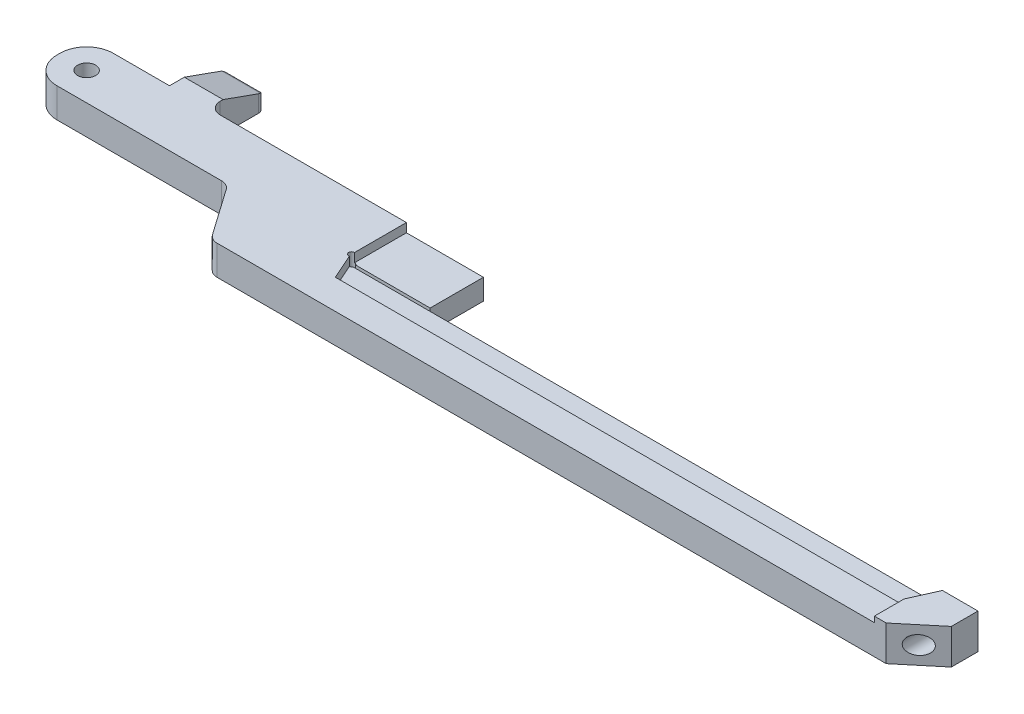
from build123d import *

# Parameters (mm, degrees)
SKETCH_1_R          = 1.525
EXTRUDE_1_DEPTH     = 5
CUT_EXTRUDE_START   = 3.5
CUT_EXTRUDE_1_DEPTH = 179.563175848
SKETCH_3_R          = 3
CUT_EXTRUDE_2_DEPTH = 2
EXTRUDE_2_DEPTH     = 5.95
SKETCH_7_R          = 1.525
CUT_EXTRUDE_3_DEPTH = 183.091741987
FILLET_4_R          = 4.5
CUT_EXTRUDE_4_DEPTH = 183.091741987
FILLET_5_R          = 2
FILLET_6_R          = 1


with BuildPart() as part:
    # 草图1 → 凸台-拉伸1 (new body)
    with BuildSketch(Plane(origin=(0, 0, 0), x_dir=(1, 0, 0), z_dir=(0, 1, 0))):
        with BuildLine():
            Line((21, 0), (21, -9.5))
            Line((21, -9.5), (54.333333333, -9.5))
            Line((54.333333333, -9.5), (61, -19))
            Line((61, -19), (65, -19))
            Line((65, -19), (175, -19))
            Line((175, -19), (181, -14))
            Line((181, -14), (181, -9.5))
            Line((181, -9.5), (75.433012702, -9.5))
            ThreePointArc((75.433012702, -9.5), (74.5, -9.25), (75.433012702, -9))
            Line((75.433012702, -9), (88, -9))
            Line((88, -9), (88, 0))
            Line((88, 0), (41.55, 0))
            Line((41.55, 0), (41.55, 9.5))
            Line((41.55, 9.5), (35, 9.5))
            Line((35, 9.5), (35, 0))
            Line((35, 0), (21, 0))
        make_face()
        with Locations(Location((25.75, -4.75, 0), (0, 0, 270))):
            Circle(SKETCH_1_R, mode=Mode.SUBTRACT)
    extrude(amount=EXTRUDE_1_DEPTH)

    # 草图2 → 切除-拉伸1 (cut, through all)
    with BuildSketch(Plane(origin=(0, 0, 0), x_dir=(1, 0, 0), z_dir=(0, 1, 0)).offset(CUT_EXTRUDE_START)):
        Polygon((75, -9), (75, 0), (88, 0), (88, -9), (75.433012702, -9), align=None)
        Polygon((75.433012702, -9.5), (175, -9.5), (173, -14), (77, -14), (75, -9.5), align=None)
    extrude(amount=CUT_EXTRUDE_1_DEPTH, mode=Mode.SUBTRACT)

    # 草图3 → 切除-拉伸2 (cut)
    with BuildSketch(Plane(origin=(0, 0, 0), x_dir=(1, 0, 0), z_dir=(0, 1, 0))):
        with Locations(Location((25.75, -4.75, 0), (0, 0, 270))):
            Circle(SKETCH_3_R)
    extrude(amount=CUT_EXTRUDE_2_DEPTH, mode=Mode.SUBTRACT)

    # 草图6 → 凸台-拉伸2 (add)
    with BuildSketch(Plane(origin=(0, 0, 0), x_dir=(1, 0, 0), z_dir=(0, 1, 0))):
        Polygon((173, -14), (173, -19), (175, -19), (181, -14), (181, -9.5), (175, -9.5), align=None)
    extrude(amount=EXTRUDE_2_DEPTH)

    # 草图7 → 切除-拉伸3 (cut, through all)
    with BuildSketch(Plane.XY):
        with Locations(Location((178, 2.975, 0), (0, 0, 180))):
            Circle(SKETCH_7_R)
    extrude(amount=CUT_EXTRUDE_3_DEPTH, mode=Mode.SUBTRACT)

    # 圆角4
    fillet_4_edges = [part.edges().sort_by_distance(p)[0] for p in [
        (21, 2.5, 9.5),
        (21, 2.5, 0),
    ]]
    fillet(fillet_4_edges, radius=FILLET_4_R)

    # 草图8 → 切除-拉伸4 (cut, through all)
    with BuildSketch(Plane(origin=(0, 0, 0), x_dir=(0, 0, -1), z_dir=(1, 0, 0))):
        Polygon((2.5, 5), (9.5, 2.5), (9.5, 5), align=None)
    extrude(amount=CUT_EXTRUDE_4_DEPTH, mode=Mode.SUBTRACT)

    # 圆角5
    fillet_5_edges = [part.edges().sort_by_distance(p)[0] for p in [
        (61, 2.5, 19),
        (54.333333333, 2.5, 9.5),
        (41.55, 2.5, 0),
    ]]
    fillet(fillet_5_edges, radius=FILLET_5_R)

    # 圆角6
    fillet_6_edges = [part.edges().sort_by_distance(p)[0] for p in [
        (35, 1.25, -9.5),
        (41.55, 1.25, -9.5),
        (38.275, 2.5, -9.5),
    ]]
    fillet(fillet_6_edges, radius=FILLET_6_R)


solid = part.part
